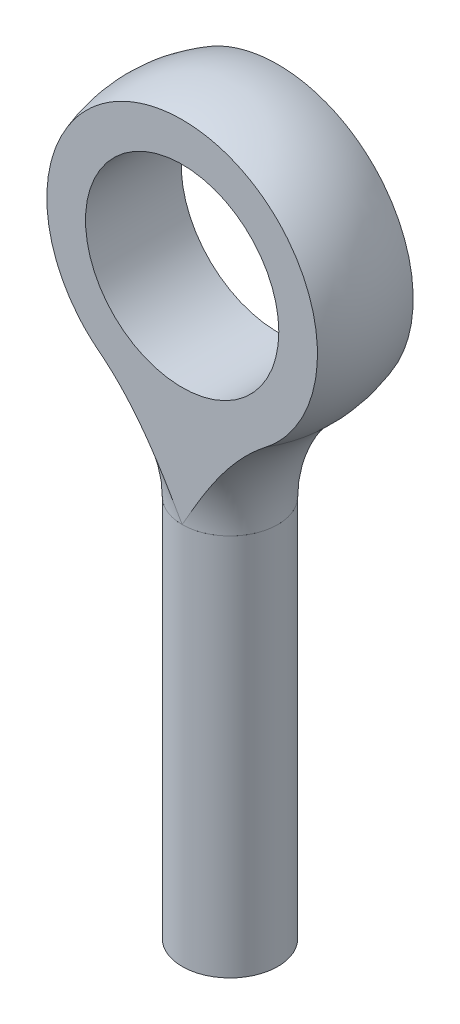
from build123d import *

# Parameters (mm, degrees)
SKETCH14_W               = 3.175
SKETCH14_H               = 25.4
CUT_EXTRUDE10_DEPTH      = 29.750847814
CUT_EXTRUDE10_DEPTH_BACK = 29.750847814
CUT_EXTRUDE9_DEPTH       = 28.312382734
CUT_EXTRUDE9_DEPTH_BACK  = 28.312382734
SKETCH17_R               = 6.4135


with BuildPart() as part:
    # Sketch14 → Revolve4 (revolve)
    with BuildSketch(Plane.XY, mode=Mode.PRIVATE) as revolve4_sk:
        with Locations((1.5875, -12.7)):
            Rectangle(SKETCH14_W, SKETCH14_H)
    revolve(revolve4_sk.sketch.rotate(Axis((0, 0, 0), (0, -1, 0)), 180), axis=Axis((0, 0, 0), (0, -1, 0)))


with BuildPart() as body_2:
    # Sketch21 → Revolve5 (revolve)
    with BuildSketch(Plane.XY):
        with BuildLine():
            Line((0, 23.8125), (0, 0))
            Line((0, 0), (3.175, 0))
            ThreePointArc((3.175, 0), (4.01304802, 3.949061991), (6.382731959, 7.217396907))
            ThreePointArc((6.382731959, 7.217396907), (8.890116899, 17.70677573), (0, 23.8125))
        make_face()
    revolve(axis=Axis((0, 0, 0), (0, -1, 0)))

    # Sketch24 → Cut-Extrude10 (cut, two sides: drawn at the far end of the back side and taken through both)
    with BuildSketch(Plane(origin=(0, 0, 0), x_dir=(0, 0, -1), z_dir=(1, 0, 0)).offset(-CUT_EXTRUDE10_DEPTH_BACK)):
        Polygon((3.175, 14.2875), (3.175, 23.8125), (9.525, 23.8125), (9.525, 0), (3.175, 0), (3.175, 0.635), align=None)
        Polygon((-3.175, 0), (-9.525, 0), (-9.525, 23.8125), (-3.175, 23.8125), (-3.175, 14.2875), (-3.175, 0.635), align=None)
    extrude(amount=CUT_EXTRUDE10_DEPTH + CUT_EXTRUDE10_DEPTH_BACK, mode=Mode.SUBTRACT)

    # Sketch17 → Cut-Extrude9 (cut, two sides: drawn at the far end of the back side and taken through both)
    with BuildSketch(Plane.XY.offset(-CUT_EXTRUDE9_DEPTH_BACK)):
        with Locations((0, 14.2875)):
            Circle(SKETCH17_R)
    extrude(amount=CUT_EXTRUDE9_DEPTH + CUT_EXTRUDE9_DEPTH_BACK, mode=Mode.SUBTRACT)


solid = Compound([part.part, body_2.part])
